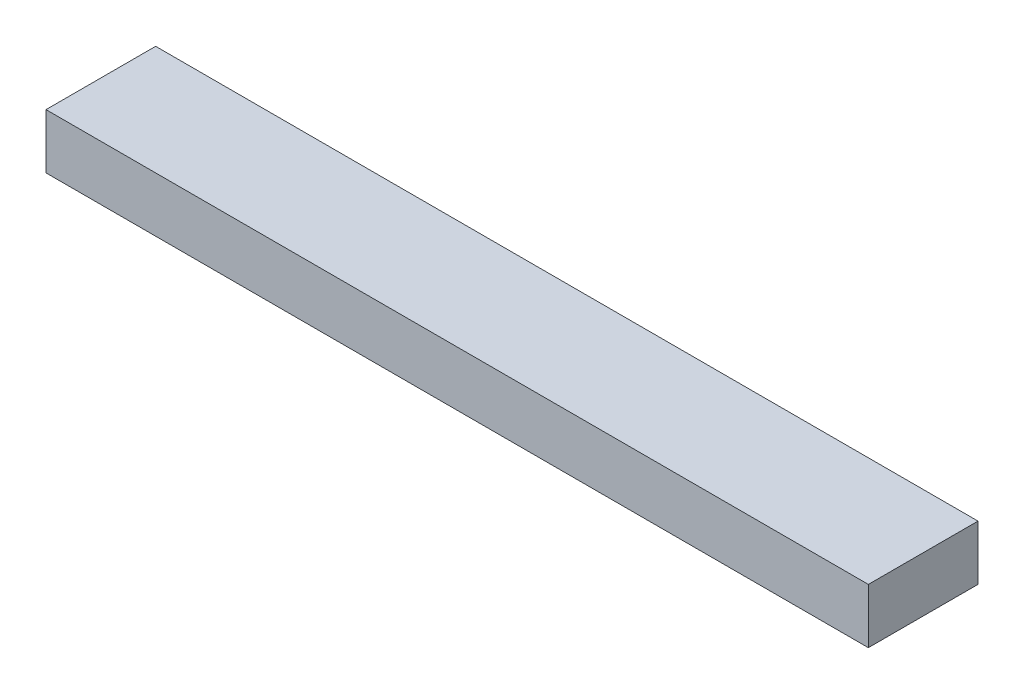
from build123d import *

# Parameters (mm, degrees)
SKETCH1_W           = 150
SKETCH1_H           = 20
BOSS_EXTRUDE1_DEPTH = 10


with BuildPart() as part:
    # Sketch1 → Boss-Extrude1 (new body)
    with BuildSketch(Plane(origin=(0, 0, 0), x_dir=(1, 0, 0), z_dir=(0, 1, 0))):
        Rectangle(SKETCH1_W, SKETCH1_H)
    extrude(amount=BOSS_EXTRUDE1_DEPTH)


solid = part.part
